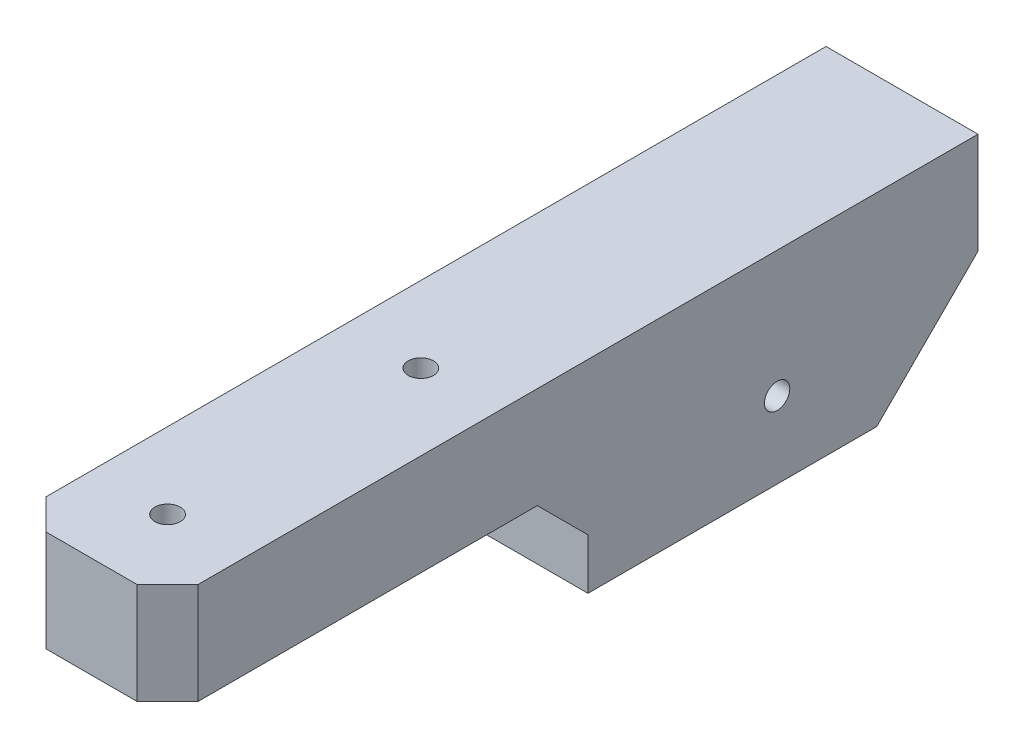
from build123d import *

# Parameters (mm, degrees)
Y_KSEKLIK_EKSTR_ZYON2_DEPTH = 30
IZIM3_R                     = 2.5
KES_EKSTR_ZYON1_DEPTH       = 30
PAH1_SIZE                   = 6
KES_EKSTR_ZYON2_DEPTH       = 30
KES_EKSTR_ZYON2_DEPTH_BACK  = 30
IZIM5_R                     = 10
IZIM6_R                     = 10
KES_EKSTR_ZYON3_DEPTH       = 15
IZIM7_R                     = 2.5
KES_EKSTR_ZYON4_DEPTH       = 48


with BuildPart() as part:
    # Çizim2 → Yükseklik-Ekstrüzyon2 (new body)
    with BuildSketch(Plane(origin=(0, 0, 0), x_dir=(0, 0, -1), z_dir=(1, 0, 0))):
        Polygon((-80, 20), (80, 20), (80, 0), (60, -20), (3, -20), (3, -10), (-7, 0), (-80, 0), align=None)
    extrude(amount=Y_KSEKLIK_EKSTR_ZYON2_DEPTH)

    # Çizim3 → Kes-Ekstrüzyon1 (cut)
    with BuildSketch(Plane(origin=(0, 20, 0), x_dir=(1, 0, 0), z_dir=(0, 1, 0))):
        with Locations((15, -15)):
            Circle(IZIM3_R)
        with Locations((15, -65)):
            Circle(IZIM3_R)
    extrude(amount=-KES_EKSTR_ZYON1_DEPTH, mode=Mode.SUBTRACT)

    # Pah1
    pah1_edges = [part.edges().sort_by_distance(p)[0] for p in [
        (0, 10, 80),
        (30, 10, 80),
    ]]
    chamfer(pah1_edges, length=PAH1_SIZE)

    # Çizim5 → Kes-Ekstrüzyon2 (cut, two sides: drawn at the far end of the back side and taken through both)
    with BuildSketch(Plane(origin=(0, -3.5, 3.5), x_dir=(1, 0, 0), z_dir=(0, -0.7071067811865488, 0.7071067811865462)).offset(-KES_EKSTR_ZYON2_DEPTH_BACK)):
        with Locations((15, -32)):
            Circle(IZIM5_R)
    extrude(amount=KES_EKSTR_ZYON2_DEPTH + KES_EKSTR_ZYON2_DEPTH_BACK, mode=Mode.SUBTRACT)

    # Çizim6 → Kes-Ekstrüzyon3 (cut)
    with BuildSketch(Plane(origin=(0, 17.713203436, -17.713203436), x_dir=(1, 0, 0), z_dir=(0, -0.7071067811865488, 0.7071067811865462))):
        with Locations((15, -32)):
            Circle(IZIM6_R)
    extrude(amount=-KES_EKSTR_ZYON3_DEPTH, mode=Mode.SUBTRACT)

    # Çizim7 → Kes-Ekstrüzyon4 (cut)
    with BuildSketch(Plane(origin=(30, 0, 0), x_dir=(0, 0, -1), z_dir=(1, 0, 0))):
        with Locations((40.340620434, -4.914213562)):
            Circle(IZIM7_R)
    extrude(amount=-KES_EKSTR_ZYON4_DEPTH, mode=Mode.SUBTRACT)


solid = part.part
